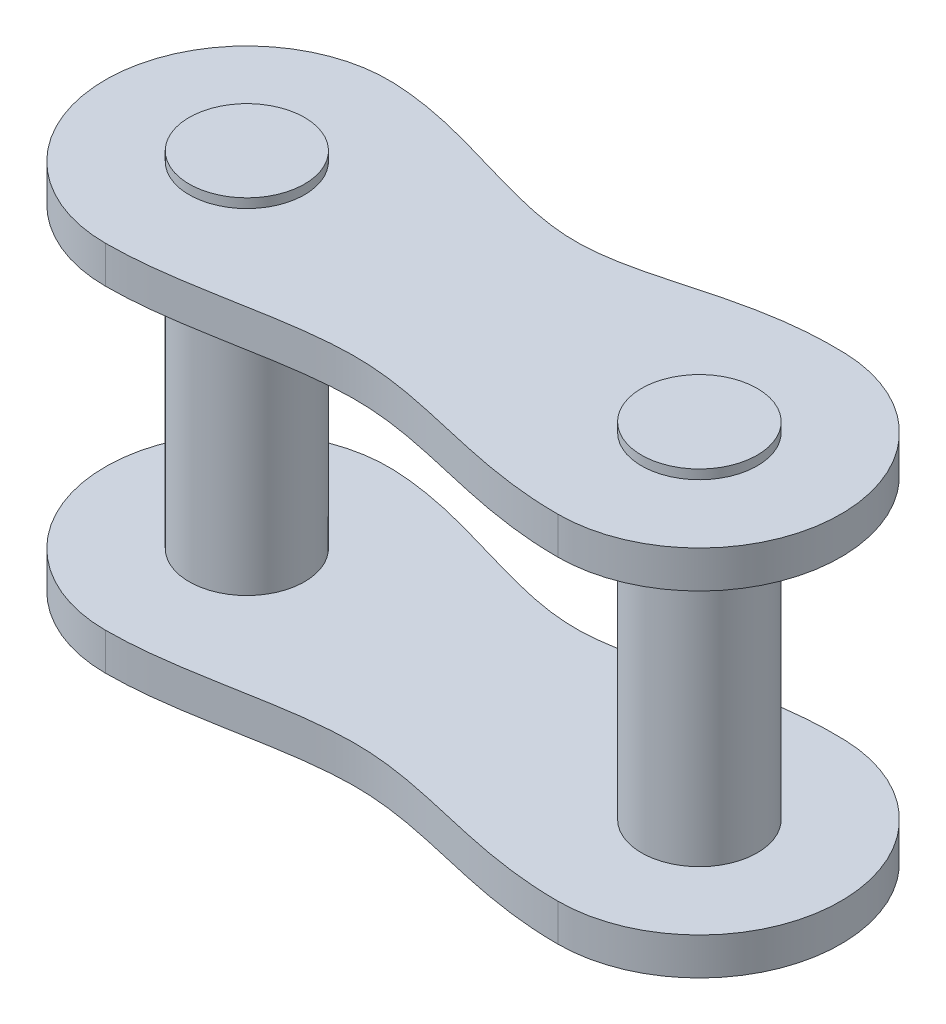
from build123d import *

# Parameters (mm, degrees)
EXTRUDE_START    = 4
SKETCH_1_R       = 1.553894019
SKETCH_1_R_2     = 1.55
EXTRUDE_7_DEPTH  = 1
EXTRUDE_START_2  = -4
SKETCH_6_R       = 1.55
SKETCH_6_R_2     = 1.553894019
EXTRUDE_11_DEPTH = 1
SKETCH_4_R       = 1.55
EXTRUDE_12_DEPTH = 5.25
SKETCH_4_5_R     = 1.55
SKETCH_4_5_R_2   = 1.553894019
EXTRUDE_13_DEPTH = 5.25


with BuildPart() as part:
    # 草图1 → 凸台-拉伸7 (new body)
    with BuildSketch(Plane(origin=(0, 0, 0), x_dir=(1, 0, 0), z_dir=(0, 1, 0)).offset(EXTRUDE_START)):
        with BuildLine():
            add(Edge.make_bspline(
                [(-56.093079937, 28.530189917), (-53.942583983, 28.449408827), (-49.768599584, 26.149491118), (-46.433977381, 28.398120151), (-43.723017894, 28.303389675)],
                knots=[0, 0, 0, 0, 0.490575379, 1, 1, 1, 1], degree=3))
            ThreePointArc((-56.093079937, 28.530189917), (-60.035052689, 24.804201821), (-56.235722287, 20.932868077))
            add(Edge.make_bspline(
                [(-56.235722287, 20.932868077), (-54.105831048, 20.932868077), (-49.896032342, 22.477788173), (-46.252423284, 20.705707547), (-43.855722287, 20.705707547)],
                knots=[0, 0, 0, 0, 0.498510271, 1, 1, 1, 1], degree=3))
            ThreePointArc((-43.855722287, 20.705707547), (-40.0563018, 24.43934523), (-43.723017894, 28.303389675))
        make_face()
        with Locations((-43.855722287, 24.505707547)):
            Circle(SKETCH_1_R, mode=Mode.SUBTRACT)
        with Locations((-56.235722287, 24.732868077)):
            Circle(SKETCH_1_R_2, mode=Mode.SUBTRACT)
    extrude(amount=EXTRUDE_7_DEPTH)



with BuildPart() as body_2:
    # 草图6 → 凸台-拉伸11 (new body)
    with BuildSketch(Plane(origin=(0, 0, 0), x_dir=(1, 0, 0), z_dir=(0, 1, 0)).offset(EXTRUDE_START_2)):
        with BuildLine():
            ThreePointArc((-56.093079937, 28.530189917), (-60.035052689, 24.804201821), (-56.235722287, 20.932868077))
            add(Edge.make_bspline(
                [(-56.235722287, 20.932868077), (-54.105831048, 20.932868077), (-49.896032342, 22.477788173), (-46.252423284, 20.705707547), (-43.855722287, 20.705707547)],
                knots=[0, 0, 0, 0, 0.498510271, 1, 1, 1, 1], degree=3))
            ThreePointArc((-43.855722287, 20.705707547), (-40.0563018, 24.43934523), (-43.723017894, 28.303389675))
            add(Edge.make_bspline(
                [(-56.093079937, 28.530189917), (-53.942583983, 28.449408827), (-49.768599584, 26.149491118), (-46.433977381, 28.398120151), (-43.723017894, 28.303389675)],
                knots=[0, 0, 0, 0, 0.490575379, 1, 1, 1, 1], degree=3))
        make_face()
        with Locations((-56.235722287, 24.732868077)):
            Circle(SKETCH_6_R, mode=Mode.SUBTRACT)
        with Locations((-43.855722287, 24.505707547)):
            Circle(SKETCH_6_R_2, mode=Mode.SUBTRACT)
    extrude(amount=-EXTRUDE_11_DEPTH)


with BuildPart() as part_1:
    add(part.part)

    add(body_2.part)  # 凸台-拉伸12 merges body 2
    # 草图4 → 凸台-拉伸12 (add, symmetric)
    with BuildSketch(Plane(origin=(0, 0, 0), x_dir=(1, 0, 0), z_dir=(0, 1, 0))):
        with Locations((-56.235722287, 24.732868077)):
            Circle(SKETCH_4_R)
    extrude(amount=EXTRUDE_12_DEPTH, both=True)

    # 草图4<5> → 凸台-拉伸13 (add, symmetric)
    with BuildSketch(Plane(origin=(0, 0, 0), x_dir=(1, 0, 0), z_dir=(0, 1, 0))):
        with Locations((-56.235722287, 24.732868077)):
            Circle(SKETCH_4_5_R)
        with Locations((-43.855722287, 24.505707547)):
            Circle(SKETCH_4_5_R_2)
    extrude(amount=EXTRUDE_13_DEPTH, both=True)


solid = part_1.part
